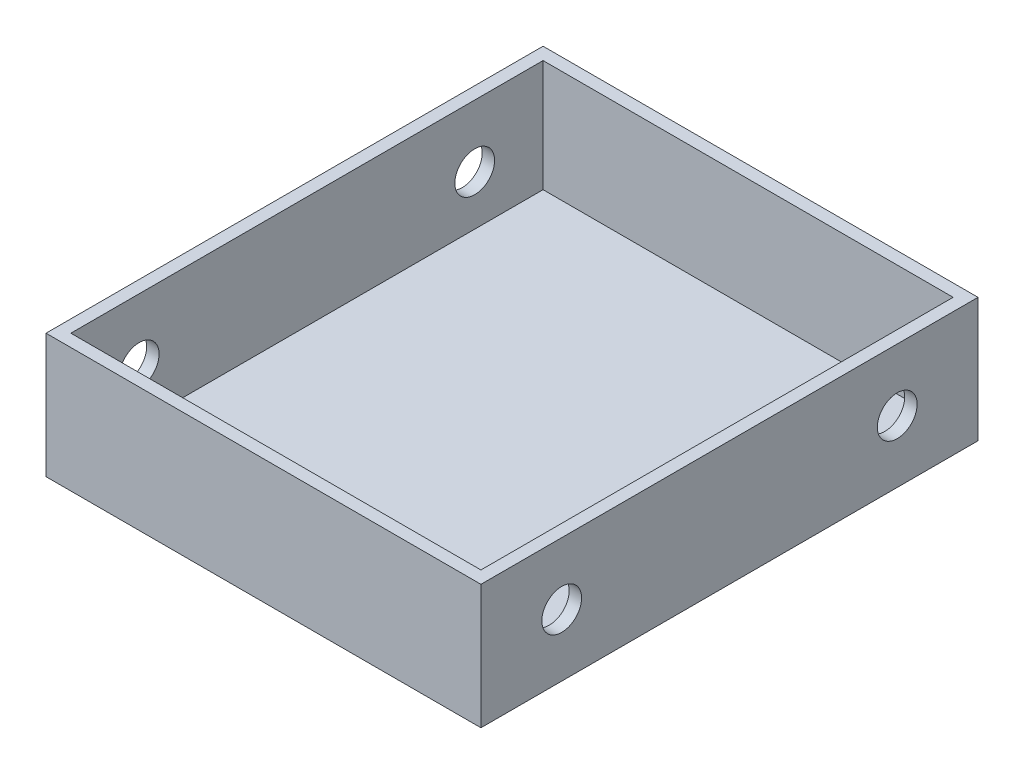
from build123d import *

# Parameters (mm, degrees)
SKETCH_1_W          = 35
SKETCH_1_H          = 40
EXTRUDE_1_DEPTH     = 10
SHELL_1_T           = -1
SKETCH_2_R          = 1.6
CUT_EXTRUDE_1_DEPTH = 55.083269132


with BuildPart() as part:
    # 草图1 → 凸台-拉伸1 (new body)
    with BuildSketch(Plane(origin=(0, 0, 0), x_dir=(1, 0, 0), z_dir=(0, 1, 0))):
        with Locations((17.5, 20)):
            Rectangle(SKETCH_1_W, SKETCH_1_H)
    extrude(amount=EXTRUDE_1_DEPTH)

    # 抽壳1
    shell_1_openings = [part.faces().sort_by_distance(p)[0] for p in [
        (17.5, 10, -20),
    ]]
    offset(amount=SHELL_1_T, openings=shell_1_openings, kind=Kind.INTERSECTION)

    # 草图2 → 切除-拉伸1 (cut, through all)
    with BuildSketch(Plane.ZY):
        with Locations((-33.5, 5)):
            Circle(SKETCH_2_R)
        with Locations((-6.5, 5)):
            Circle(SKETCH_2_R)
    extrude(amount=-CUT_EXTRUDE_1_DEPTH, mode=Mode.SUBTRACT)


solid = part.part
